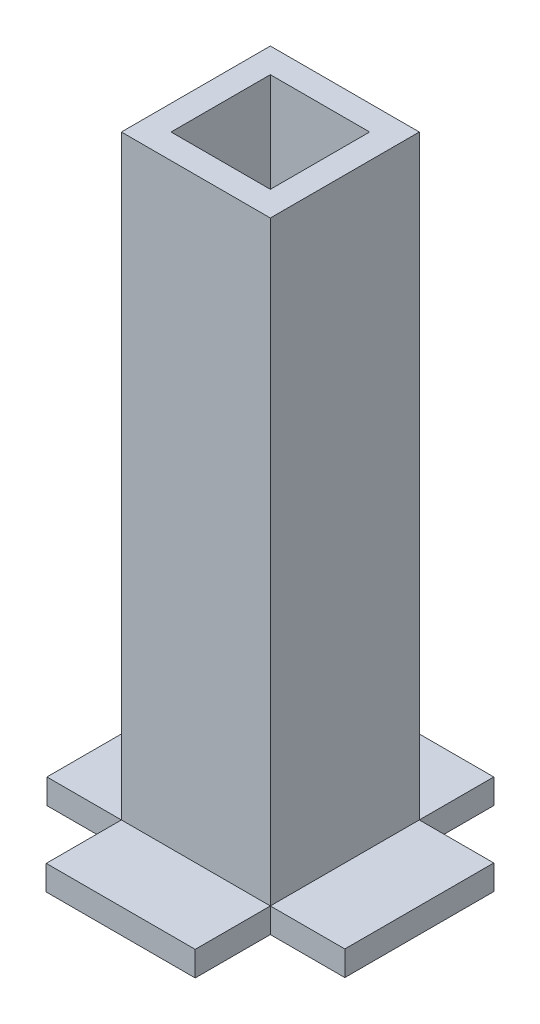
from build123d import *

# Parameters (mm, degrees)
ESQUISSE1_W             = 60
ESQUISSE1_H             = 60
BOSS_EXTRU_1_DEPTH      = 250
ESQUISSE2_W             = 40
ESQUISSE2_H             = 40
ENL_V_MAT_EXTRU_1_DEPTH = 250
ESQUISSE3_W             = 20
ESQUISSE3_H             = 41
ENL_V_MAT_EXTRU_7_DEPTH = 10
ESQUISSE4_W             = 60
ESQUISSE4_H             = 30
ESQUISSE4_W_2           = 30
ESQUISSE4_H_2           = 60
ESQUISSE4_H_3           = 30.275028017
BOSS_EXTRU_2_DEPTH      = 10
ESQUISSE6_R             = 2
ENL_V_MAT_EXTRU_8_DEPTH = 10


with BuildPart() as part:
    # Esquisse1 → Boss.-Extru.1 (new body)
    with BuildSketch(Plane(origin=(0, 0, 0), x_dir=(1, 0, 0), z_dir=(0, 1, 0))):
        with Locations((30, 30)):
            Rectangle(ESQUISSE1_W, ESQUISSE1_H)
    extrude(amount=BOSS_EXTRU_1_DEPTH)

    # Esquisse2 → Enlèv. mat.-Extru.1 (cut)
    with BuildSketch(Plane(origin=(0, 250, 0), x_dir=(1, 0, 0), z_dir=(0, 1, 0))):
        with Locations((30, 30)):
            Rectangle(ESQUISSE2_W, ESQUISSE2_H)
    extrude(amount=-ENL_V_MAT_EXTRU_1_DEPTH, mode=Mode.SUBTRACT)

    # Esquisse3 → Enlèv. mat.-Extru.7 (cut)
    with BuildSketch(Plane(origin=(0, 0, 0), x_dir=(0, 0, -1), z_dir=(1, 0, 0))):
        with Locations((30, 149.5)):
            Rectangle(ESQUISSE3_W, ESQUISSE3_H)
    extrude(amount=ENL_V_MAT_EXTRU_7_DEPTH, mode=Mode.SUBTRACT)

    # Esquisse4 → Boss.-Extru.2 (add)
    with BuildSketch(Plane(origin=(0, 0, 0), x_dir=(1, 0, 0), z_dir=(0, 1, 0))):
        with Locations((30, 75)):
            Rectangle(ESQUISSE4_W, ESQUISSE4_H)
        with Locations((-15, 30)):
            Rectangle(ESQUISSE4_W_2, ESQUISSE4_H_2)
        with Locations((75, 30)):
            Rectangle(ESQUISSE4_W_2, ESQUISSE4_H_2)
        with Locations((30, -15.137514009)):
            Rectangle(ESQUISSE4_W, ESQUISSE4_H_3)
    extrude(amount=BOSS_EXTRU_2_DEPTH)

    # Esquisse6 → Enlèv. mat.-Extru.8 (cut)
    with BuildSketch(Plane.ZY):
        with Locations((-34.5, 173.5)):
            Circle(ESQUISSE6_R)
        with Locations((-25.5, 173.5)):
            Circle(ESQUISSE6_R)
        with Locations((-34.5, 125.5)):
            Circle(ESQUISSE6_R)
        with Locations((-25.5, 125.5)):
            Circle(ESQUISSE6_R)
    extrude(amount=-ENL_V_MAT_EXTRU_8_DEPTH, mode=Mode.SUBTRACT)


solid = part.part
